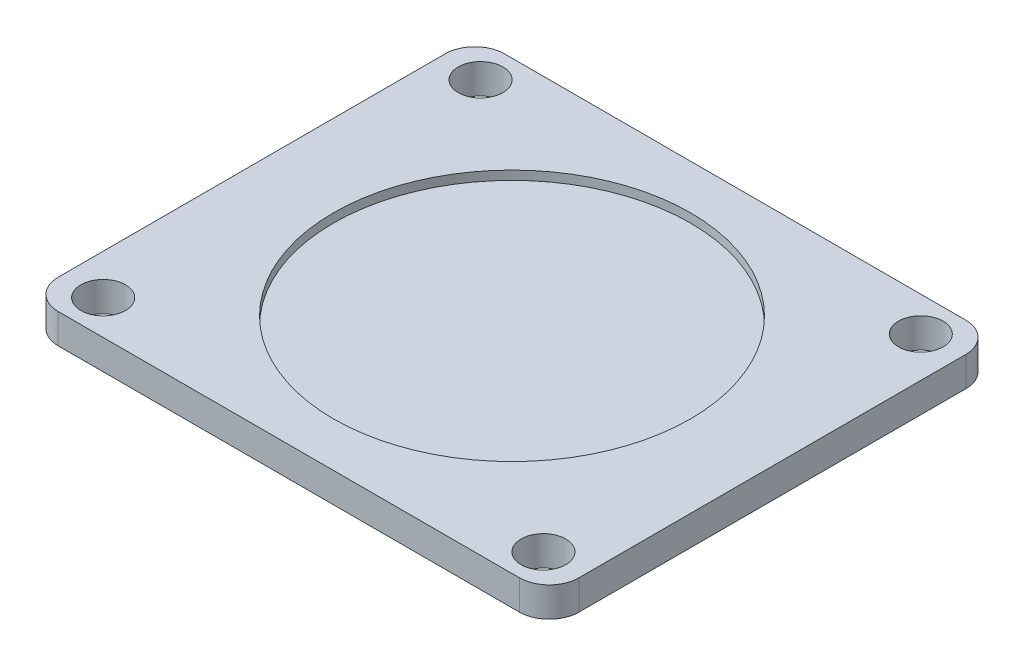
from build123d import *

# Parameters (mm, degrees)
SKETCH1_R           = 1.5
BOSS_EXTRUDE2_DEPTH = 2
SKETCH3_R           = 12
BOSS_EXTRUDE3_DEPTH = 2
SKETCH4_R           = 0.5
SKETCH5_R           = 2
BOSS_EXTRUDE4_DEPTH = 4.040735944
FILLET1_R           = 1
SKETCH7_R           = 12
CUT_EXTRUDE3_DEPTH  = 0.6


with BuildPart() as part:
    # Sketch1 → Boss-Extrude2 (new body)
    with BuildSketch(Plane(origin=(0, 0, 0), x_dir=(1, 0, 0), z_dir=(0, 1, 0))):
        with BuildLine():
            Line((-15.5, 15), (15.5, 15))
            ThreePointArc((15.5, 15), (16.914213562, 14.414213562), (17.5, 13))
            Line((17.5, 13), (17.5, -13))
            ThreePointArc((17.5, -13), (16.914213562, -14.414213562), (15.5, -15))
            Line((15.5, -15), (-15.5, -15))
            ThreePointArc((-15.5, -15), (-16.914213562, -14.414213562), (-17.5, -13))
            Line((-17.5, -13), (-17.5, 13))
            ThreePointArc((-17.5, 13), (-16.914213562, 14.414213562), (-15.5, 15))
        make_face()
        with Locations(Location((-14.79625841, 12.682507209, 0), (0, 0, 270))):
            Circle(SKETCH1_R, mode=Mode.SUBTRACT)
        with Locations(Location((-14.79625841, -12.682507209, 0), (0, 0, 270))):
            Circle(SKETCH1_R, mode=Mode.SUBTRACT)
        with Locations(Location((14.79625841, 12.682507209, 0), (0, 0, 270))):
            Circle(SKETCH1_R, mode=Mode.SUBTRACT)
        with Locations(Location((14.79625841, -12.682507209, 0), (0, 0, 270))):
            Circle(SKETCH1_R, mode=Mode.SUBTRACT)
    extrude(amount=BOSS_EXTRUDE2_DEPTH)

    # Sketch3 → Boss-Extrude3 (add)
    with BuildSketch(Plane.XZ):
        with Locations(Location((0, 0, 0), (0, 0, 90))):
            Circle(SKETCH3_R)
    extrude(amount=BOSS_EXTRUDE3_DEPTH)

    # Sketch4 → Revolve1 (revolve)
    with BuildSketch(Plane(origin=(0, 0, 0), x_dir=(0, 0, -1), z_dir=(1, 0, 0))):
        with Locations((-12, -1.5)):
            Circle(SKETCH4_R)
    revolve(axis=Axis((0, 0, 0), (0, -1, 0)))

    # Sketch5 → Boss-Extrude4 (add)
    with BuildSketch(Plane.XZ.offset(2)):
        with Locations(Location((0, 0, 0), (0, 0, 270))):
            Circle(SKETCH5_R)
    extrude(amount=BOSS_EXTRUDE4_DEPTH)

    # Fillet1
    fillet1_edges = [part.edges().sort_by_distance(p)[0] for p in [
        (0, -6.040735944, 2),
    ]]
    fillet(fillet1_edges, radius=FILLET1_R)

    # Sketch7 → Cut-Extrude3 (cut)
    with BuildSketch(Plane(origin=(0, 2, 0), x_dir=(1, 0, 0), z_dir=(0, 1, 0))):
        with Locations(Location((0, 0, 0), (0, 0, 270))):
            Circle(SKETCH7_R)
    extrude(amount=-CUT_EXTRUDE3_DEPTH, mode=Mode.SUBTRACT)


solid = part.part
